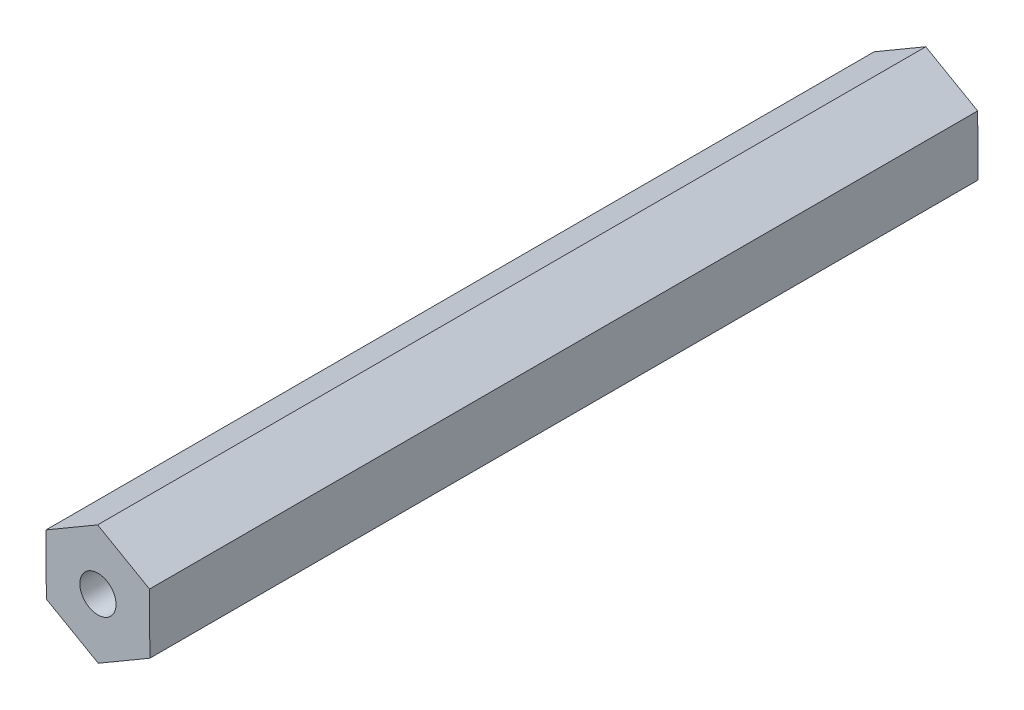
from build123d import *

# Parameters (mm, degrees)
BOSS_EXTRUDE1_DEPTH      = 40
M2_2X0_45_TAPPED_HOLE1_D = 1.75


with BuildPart() as part:
    # Sketch1 → Boss-Extrude1 (new body)
    with BuildSketch(Plane.XY):
        Polygon((2.507606751, -1.430119475), (2.492323172, 1.456591412), (-0.01528358, 2.886710887), (-2.507606751, 1.430119475), (-2.492323172, -1.456591412), (0.01528358, -2.886710887), align=None)
    extrude(amount=BOSS_EXTRUDE1_DEPTH)

    # M2.2x0.45 Tapped Hole1 (through all)
    with Locations(Plane.XY.offset(40)):
        with Locations((0, 0)):
            Hole(M2_2X0_45_TAPPED_HOLE1_D / 2)


solid = part.part
